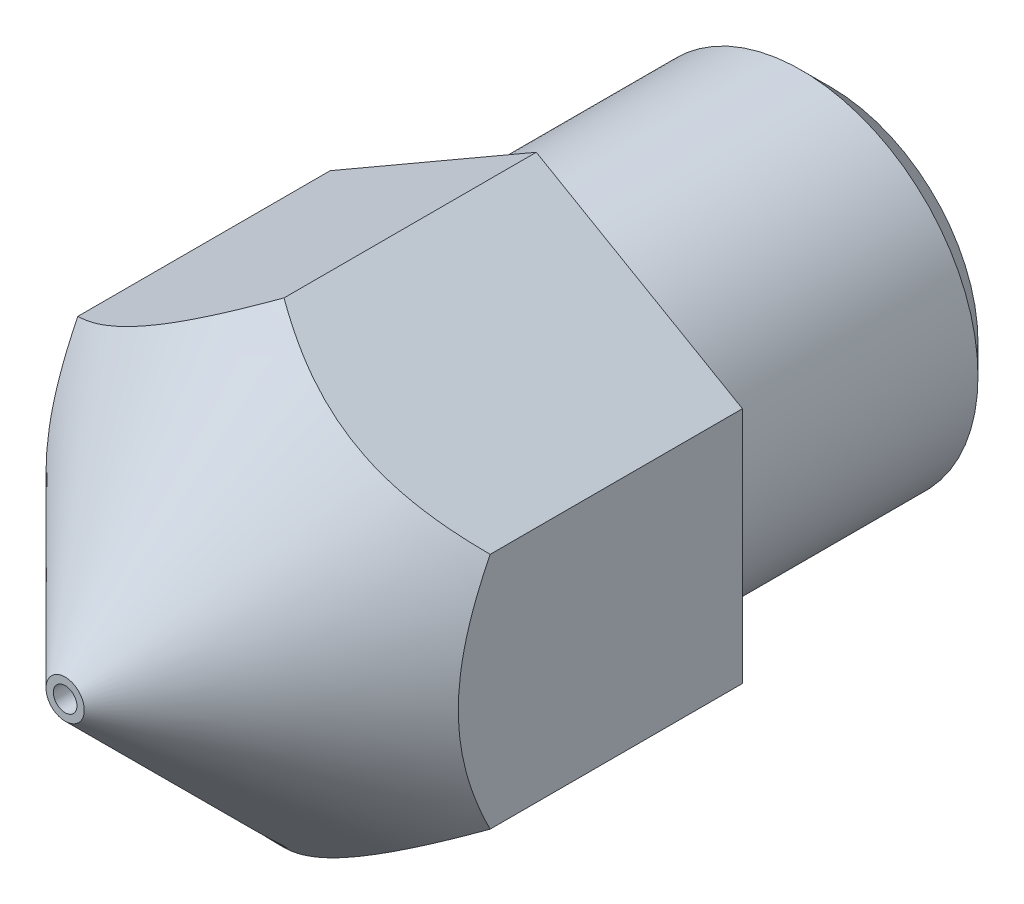
from build123d import *

# Parameters (mm, degrees)
SKETCH2_R          = 8.325
CUT_EXTRUDE2_DEPTH = 10
CHAMFER1_SIZE      = 0.5


with BuildPart() as part:
    # Sketch1 → Revolve1 (revolve)
    with BuildSketch(Plane(origin=(0, 0, 0), x_dir=(1, 0, 0), z_dir=(0, 1, 0)), mode=Mode.PRIVATE) as revolve1_sk:
        Polygon((1.19, 0), (3, 0), (3, -5), (8.325, -5), (0.325, -13), (0.2, -13), (0.2, -12.5), (1.19, -10.785269701), align=None)
    revolve(revolve1_sk.sketch.rotate(Axis((0, 0, 0), (0, 0, 1)), 180), axis=Axis((0, 0, 0), (0, 0, 1)))

    # Sketch2 → Cut-Extrude2 (cut)
    with BuildSketch(Plane(origin=(0, 0, 5), x_dir=(-1, 0, 0), z_dir=(0, 0, -1))):
        Circle(SKETCH2_R)
        Polygon((3.5, 2.020725942), (0, 4.041451884), (-3.5, 2.020725942), (-3.5, -2.020725942), (0, -4.041451884), (3.5, -2.020725942), align=None, mode=Mode.SUBTRACT)
    extrude(amount=-CUT_EXTRUDE2_DEPTH, mode=Mode.SUBTRACT)

    # Chamfer1
    chamfer1_edges = [part.edges().sort_by_distance(p)[0] for p in [
        (3, 0, 0),
    ]]
    chamfer(chamfer1_edges, length=CHAMFER1_SIZE)


solid = part.part
